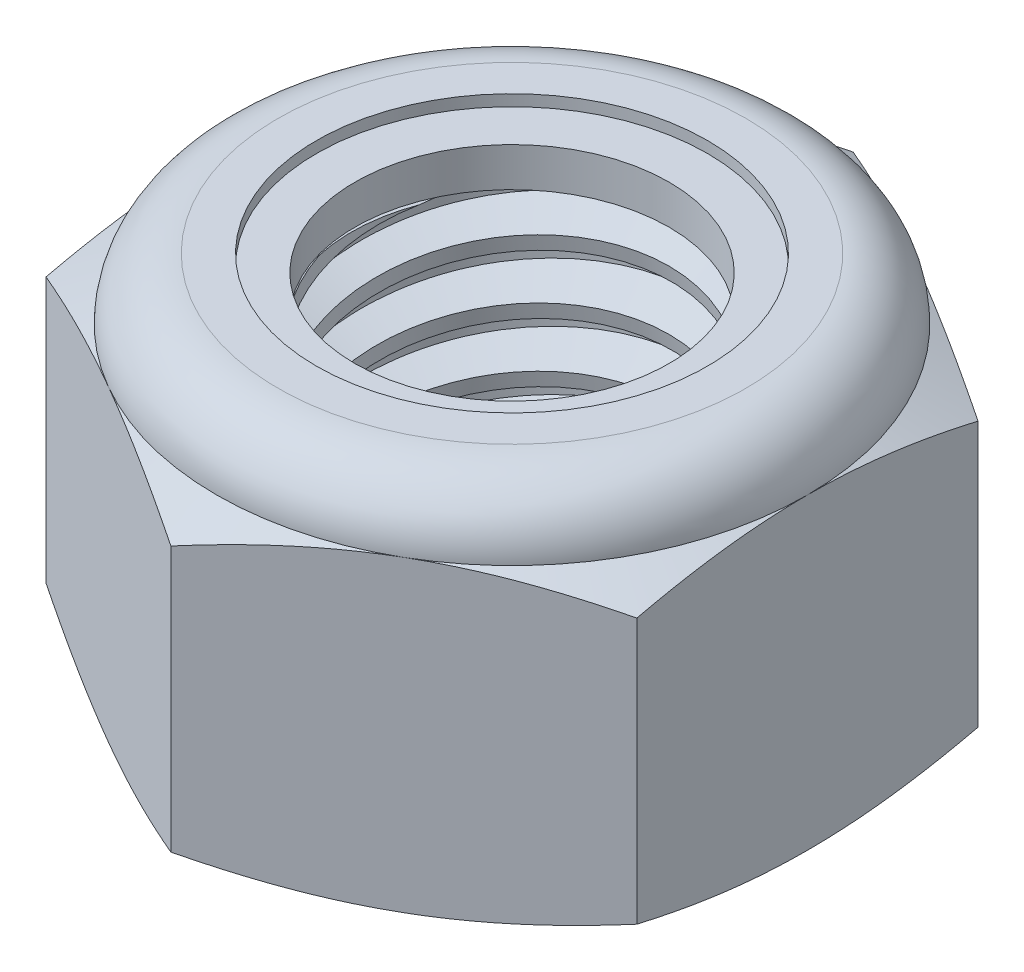
from build123d import *

# Parameters (mm, degrees)
EXTRUDE1_DEPTH      = 5
SKETCH2_W           = 2.5
SKETCH2_H           = 5
LPATTERN1_COUNT     = 6
LPATTERN1_PITCH     = 0.8
LPATTERN1_COL_COUNT = 2
LPATTERN1_COL_PITCH = 0.8


with BuildPart() as part:
    # Sketch1 → Extrude1 (new body)
    with BuildSketch(Plane(origin=(0, 0, 0), x_dir=(1, 0, 0), z_dir=(0, 1, 0))):
        Polygon((0, 4.618802154), (-4, 2.309401077), (-4, -2.309401077), (0, -4.618802154), (4, -2.309401077), (4, 2.309401077), align=None)
    extrude(amount=EXTRUDE1_DEPTH)

    # Sketch4 → Cut-Revolve2 (revolve, cut)
    with BuildSketch(Plane(origin=(0, 0, 0), x_dir=(0, 0, -1), z_dir=(1, 0, 0)), mode=Mode.PRIVATE) as cut_revolve2_sk:
        Polygon((0, 5), (2.5, 5), (2.127722339, 4.826404076), (2.127722339, 0.173595924), (2.5, 0), (0, 0), align=None)
    revolve(cut_revolve2_sk.sketch.rotate(Axis((0, 5, 0), (0, 1, 0)), 55.091745584), axis=Axis((0, 5, 0), (0, 1, 0)), mode=Mode.SUBTRACT)


with BuildPart() as body_2:
    # Sketch2 → Revolve1 (revolve)
    with BuildSketch(Plane(origin=(0, 0, 0), x_dir=(0, 0, -1), z_dir=(1, 0, 0))):
        with Locations((1.25, 2.5)):
            Rectangle(SKETCH2_W, SKETCH2_H)
    revolve(axis=Axis((0, -2.5, 0), (0, 1, 0)))

    # Sketch3 → Cut-Revolve1 (revolve, cut)
    with BuildSketch(Plane(origin=(0, 0, 0), x_dir=(0, 0, -1), z_dir=(1, 0, 0)), mode=Mode.PRIVATE) as cut_revolve1_sk:
        Polygon((2.51579905, 4.901255937), (2.626392401, 4.210047494), (2.15932044, 4.388495759), (2.127722339, 4.585983885), align=None)
    cut_revolve1 = revolve(cut_revolve1_sk.sketch.rotate(Axis((0, 5, 0.136915776), (0, -0.9874406319167054, -0.15799050110667298)), 180), axis=Axis((0, 5, 0.136915776), (0, -0.9874406319167054, -0.15799050110667298)), mode=Mode.SUBTRACT)

    # LPattern1: Cut-Revolve1 ×6
    with Locations(*[(0, -i * LPATTERN1_PITCH, 0) for i in range(1, LPATTERN1_COUNT)]):
        add(cut_revolve1, mode=Mode.SUBTRACT)

    # LPattern1 col: Cut-Revolve1 ×2
    with Locations(*[(0, i * LPATTERN1_COL_PITCH, 0) for i in range(1, LPATTERN1_COL_COUNT)]):
        add(cut_revolve1, mode=Mode.SUBTRACT)


with BuildPart() as part_1:
    add(part.part)

    # Combine1: cut body 2
    add(body_2.part, mode=Mode.SUBTRACT)

    # Sketch5 → Cut-Revolve3 (revolve, cut)
    with BuildSketch(Plane(origin=(0, 0, 0), x_dir=(0, 0, -1), z_dir=(1, 0, 0)), mode=Mode.PRIVATE) as cut_revolve3_sk:
        with BuildLine():
            Line((0, 0), (4, 0))
            Line((4, 0), (4.618802154, 0.288552183))
            Line((4.618802154, 0.288552183), (4.618802154, 3.878114484))
            Line((4.618802154, 3.878114484), (4, 4.166666667))
            ThreePointArc((4, 4.166666667), (3.755922318, 4.755922318), (3.166666667, 5))
            Line((3.166666667, 5), (3.166666667, 6.27))
            Line((3.166666667, 6.27), (5.888802154, 6.27))
            Line((5.888802154, 6.27), (5.888802154, -1.27))
            Line((5.888802154, -1.27), (0, -1.27))
            Line((0, -1.27), (0, 0))
        make_face()
    revolve(cut_revolve3_sk.sketch.rotate(Axis((0, 0, 0), (0, 1, 0)), 55.091745584), axis=Axis((0, 0, 0), (0, 1, 0)), mode=Mode.SUBTRACT)

    # Sketch6 → Cut-Revolve4 (revolve, cut)
    with BuildSketch(Plane(origin=(0, 0, 0), x_dir=(0, 0, -1), z_dir=(1, 0, 0)), mode=Mode.PRIVATE) as cut_revolve4_sk:
        with BuildLine():
            Line((0, 4.166666667), (3.8476, 4.166666667))
            ThreePointArc((3.8476, 4.166666667), (3.648159244, 4.648159244), (3.166666667, 4.8476))
            Line((3.166666667, 4.8476), (2.647194503, 4.8476))
            Line((2.647194503, 4.8476), (2.647194503, 6.27))
            Line((2.647194503, 6.27), (0, 6.27))
            Line((0, 6.27), (0, 4.166666667))
        make_face()
    revolve(cut_revolve4_sk.sketch.rotate(Axis((0, 6.27, 0), (0, 1, 0)), 55.091745584), axis=Axis((0, 6.27, 0), (0, 1, 0)), mode=Mode.SUBTRACT)


with BuildPart() as body_2_2:
    # Sketch7 → Revolve2 (revolve)
    with BuildSketch(Plane(origin=(0, 0, 0), x_dir=(0, 0, -1), z_dir=(1, 0, 0))):
        with BuildLine():
            Line((2.127722339, 4.242866667), (3.766579964, 4.242866667))
            ThreePointArc((3.766579964, 4.242866667), (3.566430175, 4.620419399), (3.166666667, 4.7714))
            Line((3.166666667, 4.7714), (2.127722339, 4.7714))
            Line((2.127722339, 4.7714), (2.127722339, 4.242866667))
        make_face()
    revolve(axis=Axis((0, 4.242866667, 0), (0, 1, 0)))


solid = Compound([part_1.part, body_2_2.part])
